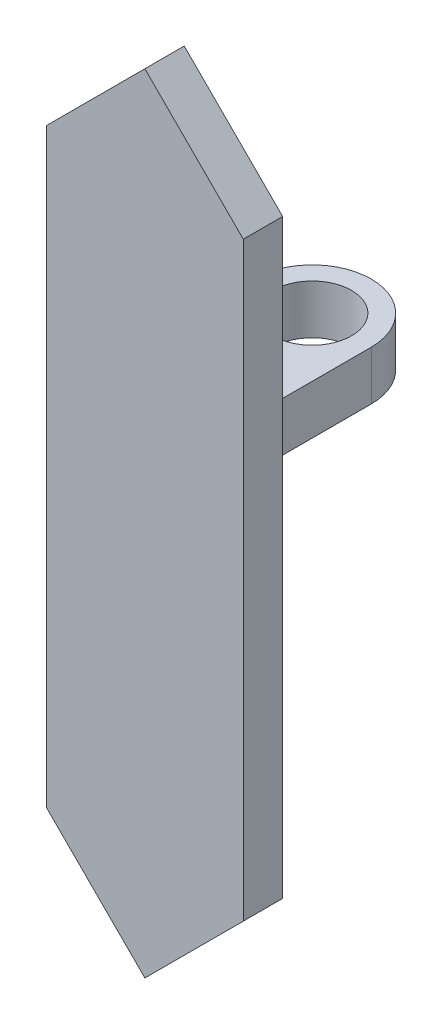
from build123d import *

# Parameters (mm, degrees)
EXTRUDE_1_DEPTH     = 4
SKETCH_2_W          = 12
SKETCH_2_H          = 5
EXTRUDE_2_DEPTH     = 20
SKETCH_6_R          = 4
CUT_EXTRUDE_5_DEPTH = 21


with BuildPart() as part:
    # 草图1 → 凸台-拉伸1 (new body)
    with BuildSketch(Plane.XY):
        Polygon((0.147281285, 10), (0.147281285, 70), (10.147281285, 80), (20.147281285, 70), (20.147281285, 10), (10.147281285, 0), align=None)
    extrude(amount=EXTRUDE_1_DEPTH)

    # 草图2 → 凸台-拉伸2 (add)
    with BuildSketch(Plane(origin=(0, 0, 0), x_dir=(-1, 0, 0), z_dir=(0, 0, -1))):
        with Locations((-10.147281285, 47.5)):
            Rectangle(SKETCH_2_W, SKETCH_2_H)
    extrude(amount=EXTRUDE_2_DEPTH)

    # 草图6 → 切除-拉伸5 (cut)
    with BuildSketch(Plane.XZ.offset(-45)):
        with Locations(Location((10.147281285, -13, 0), (0, 0, 270))):
            Circle(SKETCH_6_R)
        with BuildLine():
            Line((16.147281285, -20), (16.147281285, -13))
            ThreePointArc((16.147281285, -13), (10.147281285, -19), (4.147281285, -13))
            Line((4.147281285, -13), (4.147281285, -20))
            Line((4.147281285, -20), (16.147281285, -20))
        make_face()
    extrude(amount=-CUT_EXTRUDE_5_DEPTH, mode=Mode.SUBTRACT)


solid = part.part
